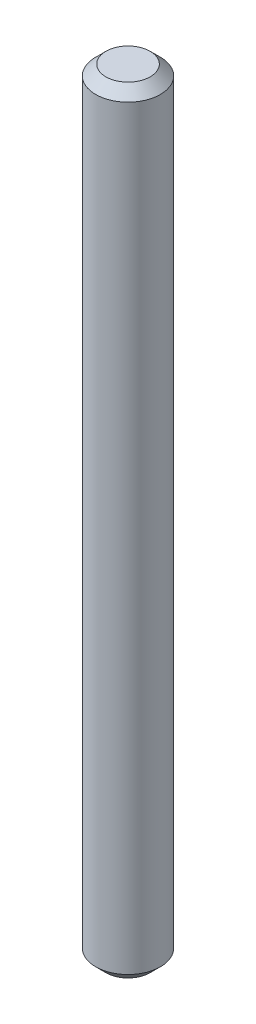
from build123d import *

# Parameters (mm, degrees)
SKETCH1_R           = 3.175
BOSS_EXTRUDE1_DEPTH = 76.2
CHAMFER1_SIZE       = 1


with BuildPart() as part:
    # Sketch1 → Boss-Extrude1 (new body)
    with BuildSketch(Plane(origin=(0, 0, 0), x_dir=(1, 0, 0), z_dir=(0, 1, 0))):
        with Locations(Location((0, 0, 0), (0, 0, 90))):
            Circle(SKETCH1_R)
    extrude(amount=BOSS_EXTRUDE1_DEPTH)

    # Chamfer1
    chamfer1_edges = [part.edges().sort_by_distance(p)[0] for p in [
        (0, 0, 3.175),
        (0, 76.2, 3.175),
    ]]
    chamfer(chamfer1_edges, length=CHAMFER1_SIZE)


solid = part.part
